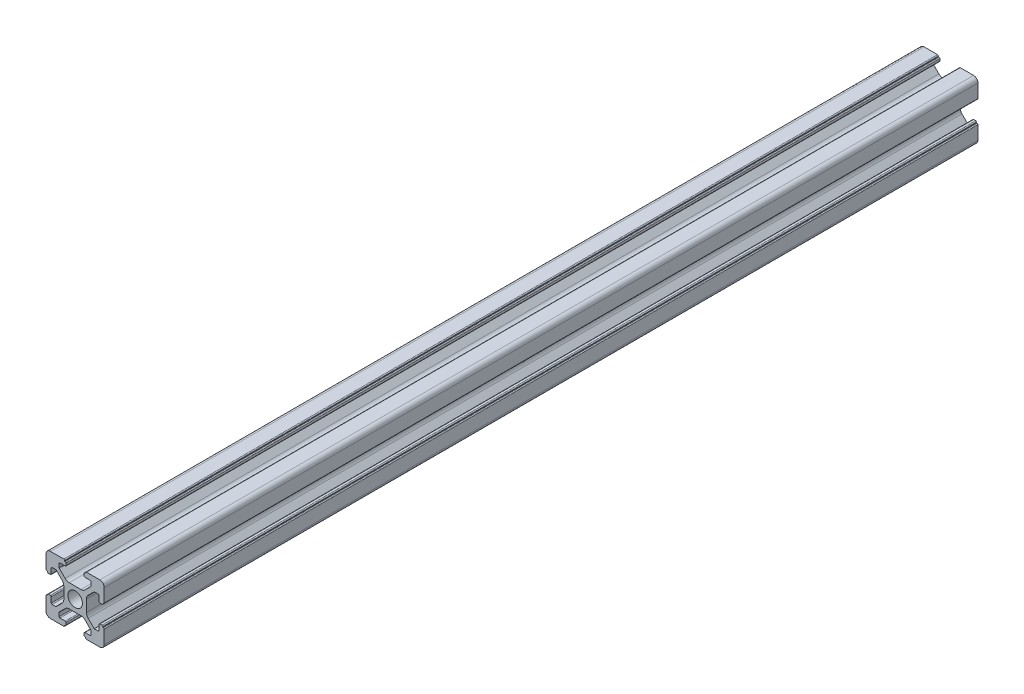
from build123d import *

# Parameters (mm, degrees)
MODEL_R                 = 2.5
BOSS_EXTRUDE1_DEPTH     = 300
CUT_EXTRUDE1_DEPTH      = 301.83217913
CUT_EXTRUDE1_DEPTH_BACK = 301.83217913
SKETCH1_R               = 2.4
SKETCH2_R               = 1.45
CUT_EXTRUDE2_DEPTH      = 18
SKETCH5_R               = 1.5
CUT_EXTRUDE4_DEPTH      = 58


with BuildPart() as part:
    # Model → Boss-Extrude1 (new body)
    with BuildSketch(Plane.XY):
        with BuildLine():
            Line((3.9, 0), (3.9, -2.010912703))
            ThreePointArc((3.9, -2.010912703), (4.052240935, -2.776279568), (4.485786438, -3.425126266))
            Line((4.485786438, -3.425126266), (6.560660172, -5.5))
            Line((6.560660172, -5.5), (7.9, -5.5))
            ThreePointArc((7.9, -5.5), (8.112132034, -5.412132034), (8.2, -5.2))
            Line((8.2, -5.2), (8.2, -3.4))
            ThreePointArc((8.2, -3.4), (8.287867966, -3.187867966), (8.5, -3.1))
            Line((8.5, -3.1), (9.2, -3.1))
            ThreePointArc((9.2, -3.1), (9.412132034, -3.187867966), (9.5, -3.4))
            Line((9.5, -3.4), (9.5, -3.6))
            Line((9.5, -3.6), (9.7, -3.6))
            ThreePointArc((9.7, -3.6), (9.912132034, -3.687867966), (10, -3.9))
            Line((10, -3.9), (10, -8.5))
            ThreePointArc((10, -8.5), (9.560660172, -9.560660172), (8.5, -10))
            Line((8.5, -10), (3.9, -10))
            ThreePointArc((3.9, -10), (3.687867966, -9.912132034), (3.6, -9.7))
            ThreePointArc((3.6, -9.7), (3.541421356, -9.558578644), (3.4, -9.5))
            ThreePointArc((3.4, -9.5), (3.187867966, -9.412132034), (3.1, -9.2))
            Line((3.1, -9.2), (3.1, -8.5))
            ThreePointArc((3.1, -8.5), (3.187867966, -8.287867966), (3.4, -8.2))
            Line((3.4, -8.2), (5.2, -8.2))
            ThreePointArc((5.2, -8.2), (5.412132034, -8.112132034), (5.5, -7.9))
            Line((5.5, -7.9), (5.5, -6.68492424))
            ThreePointArc((5.5, -6.68492424), (5.47716386, -6.570119211), (5.412132034, -6.472792206))
            Line((5.412132034, -6.472792206), (3.425126266, -4.485786438))
            ThreePointArc((3.425126266, -4.485786438), (2.776279568, -4.052240935), (2.010912703, -3.9))
            Line((2.010912703, -3.9), (0, -3.9))
            Line((0, -3.9), (-2.010912703, -3.9))
            ThreePointArc((-2.010912703, -3.9), (-2.776279568, -4.052240935), (-3.425126266, -4.485786438))
            Line((-3.425126266, -4.485786438), (-5.412132034, -6.472792206))
            ThreePointArc((-5.412132034, -6.472792206), (-5.47716386, -6.570119211), (-5.5, -6.68492424))
            Line((-5.5, -6.68492424), (-5.5, -7.9))
            ThreePointArc((-5.5, -7.9), (-5.412132034, -8.112132034), (-5.2, -8.2))
            Line((-5.2, -8.2), (-3.4, -8.2))
            ThreePointArc((-3.4, -8.2), (-3.187867966, -8.287867966), (-3.1, -8.5))
            Line((-3.1, -8.5), (-3.1, -9.2))
            ThreePointArc((-3.1, -9.2), (-3.187867966, -9.412132034), (-3.4, -9.5))
            ThreePointArc((-3.4, -9.5), (-3.541421356, -9.558578644), (-3.6, -9.7))
            ThreePointArc((-3.6, -9.7), (-3.687867966, -9.912132034), (-3.9, -10))
            Line((-3.9, -10), (-8.5, -10))
            ThreePointArc((-8.5, -10), (-9.560660172, -9.560660172), (-10, -8.5))
            Line((-10, -8.5), (-10, -3.9))
            ThreePointArc((-10, -3.9), (-9.912132034, -3.687867966), (-9.7, -3.6))
            Line((-9.7, -3.6), (-9.5, -3.6))
            Line((-9.5, -3.6), (-9.5, -3.4))
            ThreePointArc((-9.5, -3.4), (-9.412132034, -3.187867966), (-9.2, -3.1))
            Line((-9.2, -3.1), (-8.5, -3.1))
            ThreePointArc((-8.5, -3.1), (-8.287867966, -3.187867966), (-8.2, -3.4))
            Line((-8.2, -3.4), (-8.2, -5.2))
            ThreePointArc((-8.2, -5.2), (-8.112132034, -5.412132034), (-7.9, -5.5))
            Line((-7.9, -5.5), (-6.68492424, -5.5))
            ThreePointArc((-6.68492424, -5.5), (-6.570119211, -5.47716386), (-6.472792206, -5.412132034))
            Line((-6.472792206, -5.412132034), (-4.485786438, -3.425126266))
            ThreePointArc((-4.485786438, -3.425126266), (-4.052240935, -2.776279568), (-3.9, -2.010912703))
            Line((-3.9, -2.010912703), (-3.9, 0))
            Line((-3.9, 0), (-3.9, 2.010912703))
            ThreePointArc((-3.9, 2.010912703), (-4.052240935, 2.776279568), (-4.485786438, 3.425126266))
            Line((-4.485786438, 3.425126266), (-6.472792206, 5.412132034))
            ThreePointArc((-6.472792206, 5.412132034), (-6.570119211, 5.47716386), (-6.68492424, 5.5))
            Line((-6.68492424, 5.5), (-7.9, 5.5))
            ThreePointArc((-7.9, 5.5), (-8.112132034, 5.412132034), (-8.2, 5.2))
            Line((-8.2, 5.2), (-8.2, 3.4))
            ThreePointArc((-8.2, 3.4), (-8.287867966, 3.187867966), (-8.5, 3.1))
            Line((-8.5, 3.1), (-9.2, 3.1))
            ThreePointArc((-9.2, 3.1), (-9.412132034, 3.187867966), (-9.5, 3.4))
            Line((-9.5, 3.4), (-9.5, 3.6))
            Line((-9.5, 3.6), (-9.7, 3.6))
            ThreePointArc((-9.7, 3.6), (-9.912132034, 3.687867966), (-10, 3.9))
            Line((-10, 3.9), (-10, 8.5))
            ThreePointArc((-10, 8.5), (-9.560660172, 9.560660172), (-8.5, 10))
            Line((-8.5, 10), (-3.9, 10))
            ThreePointArc((-3.9, 10), (-3.687867966, 9.912132034), (-3.6, 9.7))
            Line((-3.6, 9.7), (-3.6, 9.5))
            Line((-3.6, 9.5), (-3.4, 9.5))
            ThreePointArc((-3.4, 9.5), (-3.187867966, 9.412132034), (-3.1, 9.2))
            Line((-3.1, 9.2), (-3.1, 8.5))
            ThreePointArc((-3.1, 8.5), (-3.187867966, 8.287867965), (-3.4, 8.2))
            Line((-3.4, 8.2), (-5.2, 8.2))
            ThreePointArc((-5.2, 8.2), (-5.412132034, 8.112132034), (-5.5, 7.9))
            Line((-5.5, 7.9), (-5.5, 6.68492424))
            ThreePointArc((-5.5, 6.68492424), (-5.47716386, 6.570119211), (-5.412132034, 6.472792206))
            Line((-5.412132034, 6.472792206), (-3.425126266, 4.485786438))
            ThreePointArc((-3.425126266, 4.485786438), (-2.776279568, 4.052240935), (-2.010912703, 3.9))
            Line((-2.010912703, 3.9), (0, 3.9))
            Line((0, 3.9), (2.010912703, 3.9))
            ThreePointArc((2.010912703, 3.9), (2.776279568, 4.052240935), (3.425126266, 4.485786438))
            Line((3.425126266, 4.485786438), (5.412132034, 6.472792206))
            ThreePointArc((5.412132034, 6.472792206), (5.47716386, 6.570119211), (5.5, 6.68492424))
            Line((5.5, 6.68492424), (5.5, 7.9))
            ThreePointArc((5.5, 7.9), (5.412132034, 8.112132034), (5.2, 8.2))
            Line((5.2, 8.2), (3.4, 8.2))
            ThreePointArc((3.4, 8.2), (3.187867966, 8.287867965), (3.1, 8.5))
            Line((3.1, 8.5), (3.1, 9.2))
            ThreePointArc((3.1, 9.2), (3.187867966, 9.412132034), (3.4, 9.5))
            Line((3.4, 9.5), (3.6, 9.5))
            Line((3.6, 9.5), (3.6, 9.7))
            ThreePointArc((3.6, 9.7), (3.687867966, 9.912132034), (3.9, 10))
            Line((3.9, 10), (8.5, 10))
            ThreePointArc((8.5, 10), (9.560660172, 9.560660172), (10, 8.5))
            Line((10, 8.5), (10, 3.9))
            ThreePointArc((10, 3.9), (9.912132034, 3.687867966), (9.7, 3.6))
            Line((9.7, 3.6), (9.5, 3.6))
            Line((9.5, 3.6), (9.5, 3.4))
            ThreePointArc((9.5, 3.4), (9.412132034, 3.187867966), (9.2, 3.1))
            Line((9.2, 3.1), (8.5, 3.1))
            ThreePointArc((8.5, 3.1), (8.287867966, 3.187867966), (8.2, 3.4))
            Line((8.2, 3.4), (8.2, 5.2))
            ThreePointArc((8.2, 5.2), (8.112132034, 5.412132034), (7.9, 5.5))
            Line((7.9, 5.5), (6.68492424, 5.5))
            ThreePointArc((6.68492424, 5.5), (6.570119211, 5.47716386), (6.472792206, 5.412132034))
            Line((6.472792206, 5.412132034), (4.485786438, 3.425126266))
            ThreePointArc((4.485786438, 3.425126266), (4.052240935, 2.776279568), (3.9, 2.010912703))
            Line((3.9, 2.010912703), (3.9, 0))
        make_face()
        Circle(MODEL_R, mode=Mode.SUBTRACT)
    extrude(amount=BOSS_EXTRUDE1_DEPTH)

    # Sketch1 → Cut-Extrude1 (cut, two sides: drawn at the far end of the back side and taken through both)
    with BuildSketch(Plane(origin=(10, 0, 0), x_dir=(0, 0, -1), z_dir=(1, 0, 0)).offset(-CUT_EXTRUDE1_DEPTH_BACK)):
        with Locations((-150, 0)):
            Circle(SKETCH1_R)
    extrude(amount=CUT_EXTRUDE1_DEPTH + CUT_EXTRUDE1_DEPTH_BACK, mode=Mode.SUBTRACT)

    # Sketch2 → Cut-Extrude2 (cut)
    with BuildSketch(Plane(origin=(0, 3.9, 0), x_dir=(1, 0, 0), z_dir=(0, 1, 0))):
        with Locations(Location((0, -15, 0), (0, 0, 180))):
            Circle(SKETCH2_R)
    cut_extrude2 = extrude(amount=-CUT_EXTRUDE2_DEPTH, mode=Mode.SUBTRACT)

    # Mirror1: Cut-Extrude2 across plane
    add(cut_extrude2.mirror(Plane(origin=(0, 0, 150), x_dir=(1, 0, 0), z_dir=(0, 0, -1))), mode=Mode.SUBTRACT)

    # Sketch5 → Cut-Extrude4 (cut)
    with BuildSketch(Plane.XZ.offset(3.9)):
        with Locations(Location((0, 170, 0), (0, 0, 270))):
            Circle(SKETCH5_R)
        with Locations(Location((0, 130, 0), (0, 0, 270))):
            Circle(SKETCH5_R)
    extrude(amount=-CUT_EXTRUDE4_DEPTH, mode=Mode.SUBTRACT)


solid = part.part
